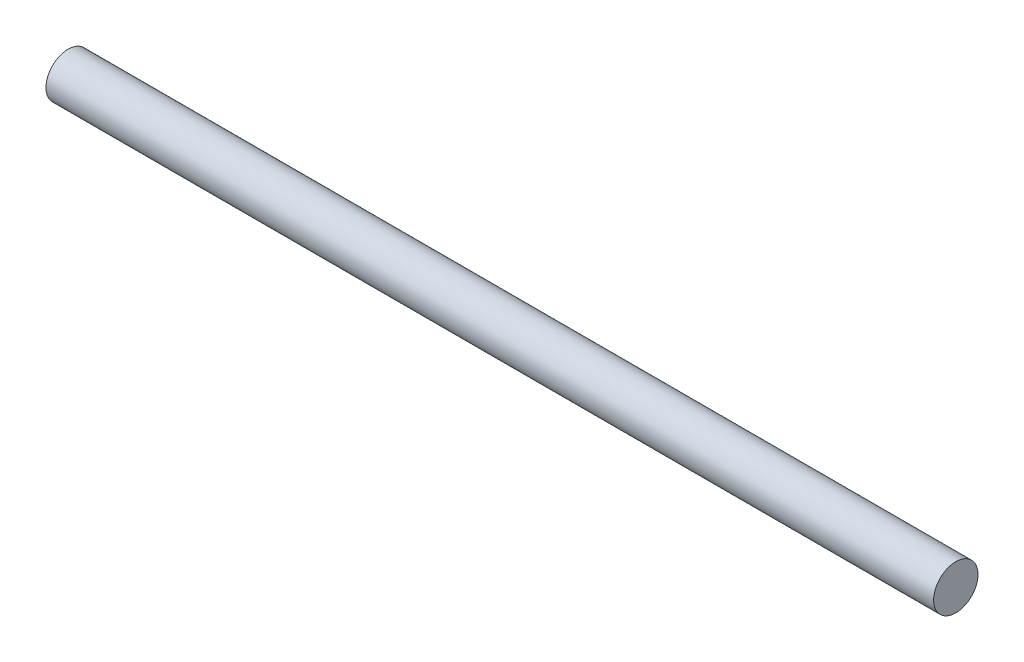
from build123d import *

# Parameters (mm, degrees)
SKETCH1_R           = 3.175
BOSS_EXTRUDE1_DEPTH = 127


with BuildPart() as part:
    # Sketch1 → Boss-Extrude1 (new body)
    with BuildSketch(Plane(origin=(0, 0, 0), x_dir=(0, 0, -1), z_dir=(1, 0, 0))):
        Circle(SKETCH1_R)
    extrude(amount=BOSS_EXTRUDE1_DEPTH)


solid = part.part
